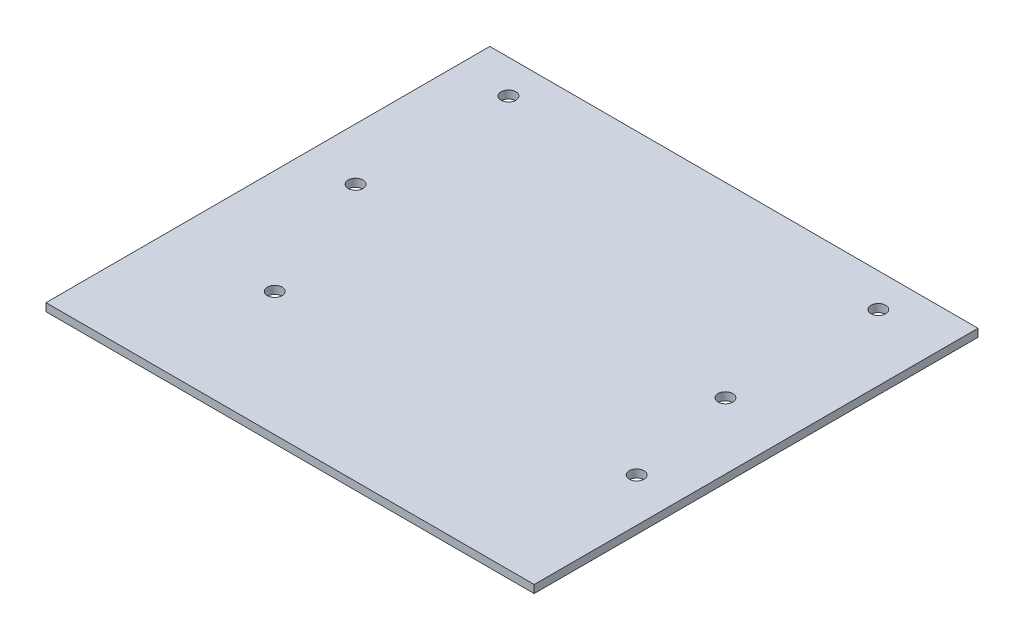
from build123d import *

# Parameters (mm, degrees)
SKETCH_1_W      = 99
SKETCH_1_H      = 90
SKETCH_1_R      = 1.5
EXTRUDE_1_DEPTH = 1.6


with BuildPart() as part:
    # Эскиз1 → Бобышка-Вытянуть1 (new body)
    with BuildSketch(Plane(origin=(0, 0, 0), x_dir=(1, 0, 0), z_dir=(0, 1, 0))):
        with Locations((49.5, 45)):
            Rectangle(SKETCH_1_W, SKETCH_1_H)
        with Locations(Location((10.599573333, 83.180186135, 0), (0, 0, 270))):
            Circle(SKETCH_1_R, mode=Mode.SUBTRACT)
        with Locations(Location((85.599573333, 83.180186135, 0), (0, 0, 270))):
            Circle(SKETCH_1_R, mode=Mode.SUBTRACT)
        with Locations(Location((10.599573333, 52.180186135, 0), (0, 0, 270))):
            Circle(SKETCH_1_R, mode=Mode.SUBTRACT)
        with Locations(Location((85.599573333, 52.180186135, 0), (0, 0, 270))):
            Circle(SKETCH_1_R, mode=Mode.SUBTRACT)
        with Locations(Location((21.219461241, 25.169956409, 0), (0, 0, 270))):
            Circle(SKETCH_1_R, mode=Mode.SUBTRACT)
        with Locations(Location((90.153808785, 29.62232479, 0), (0, 0, 270))):
            Circle(SKETCH_1_R, mode=Mode.SUBTRACT)
    extrude(amount=EXTRUDE_1_DEPTH)


solid = part.part
